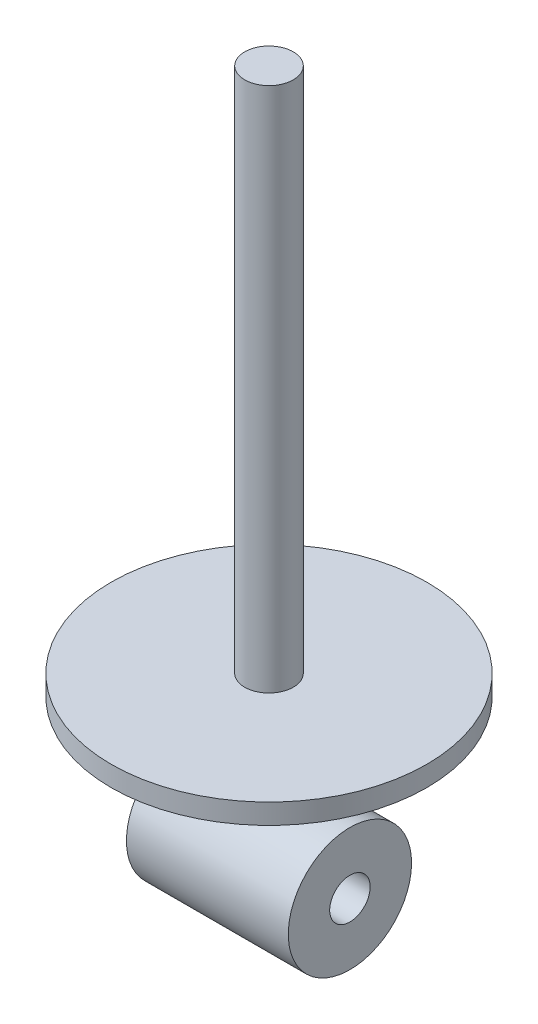
from build123d import *

# Parameters (mm, degrees)
SKETCH4_R           = 39
BOSS_EXTRUDE2_DEPTH = 5
SKETCH5_R           = 6
BOSS_EXTRUDE3_DEPTH = 130
SKETCH6_R           = 7.5
BOSS_EXTRUDE4_DEPTH = 20
SKETCH8_R           = 15.233231967
SKETCH8_R_2         = 5
BOSS_EXTRUDE5_DEPTH = 20


with BuildPart() as part:
    # Sketch4 → Boss-Extrude2 (new body)
    with BuildSketch(Plane(origin=(0, 0, 0), x_dir=(1, 0, 0), z_dir=(0, 1, 0))):
        with Locations(Location((0, 0, 0), (0, 0, 270))):
            Circle(SKETCH4_R)
    extrude(amount=BOSS_EXTRUDE2_DEPTH)

    # Sketch5 → Boss-Extrude3 (add)
    with BuildSketch(Plane(origin=(0, 5, 0), x_dir=(1, 0, 0), z_dir=(0, 1, 0))):
        with Locations(Location((0, 0, 0), (0, 0, 270))):
            Circle(SKETCH5_R)
    extrude(amount=BOSS_EXTRUDE3_DEPTH)

    # Sketch6 → Boss-Extrude4 (add)
    with BuildSketch(Plane.XZ):
        with Locations(Location((0, 0, 0), (0, 0, 270))):
            Circle(SKETCH6_R)
    extrude(amount=BOSS_EXTRUDE4_DEPTH)

    # Sketch8 → Boss-Extrude5 (add, symmetric)
    with BuildSketch(Plane(origin=(0, 0, 0), x_dir=(0, 0, -1), z_dir=(1, 0, 0))):
        with Locations((0, -33.226479946)):
            Circle(SKETCH8_R)
        with Locations((0, -33.226479946)):
            Circle(SKETCH8_R_2, mode=Mode.SUBTRACT)
    extrude(amount=BOSS_EXTRUDE5_DEPTH, both=True)


solid = part.part
